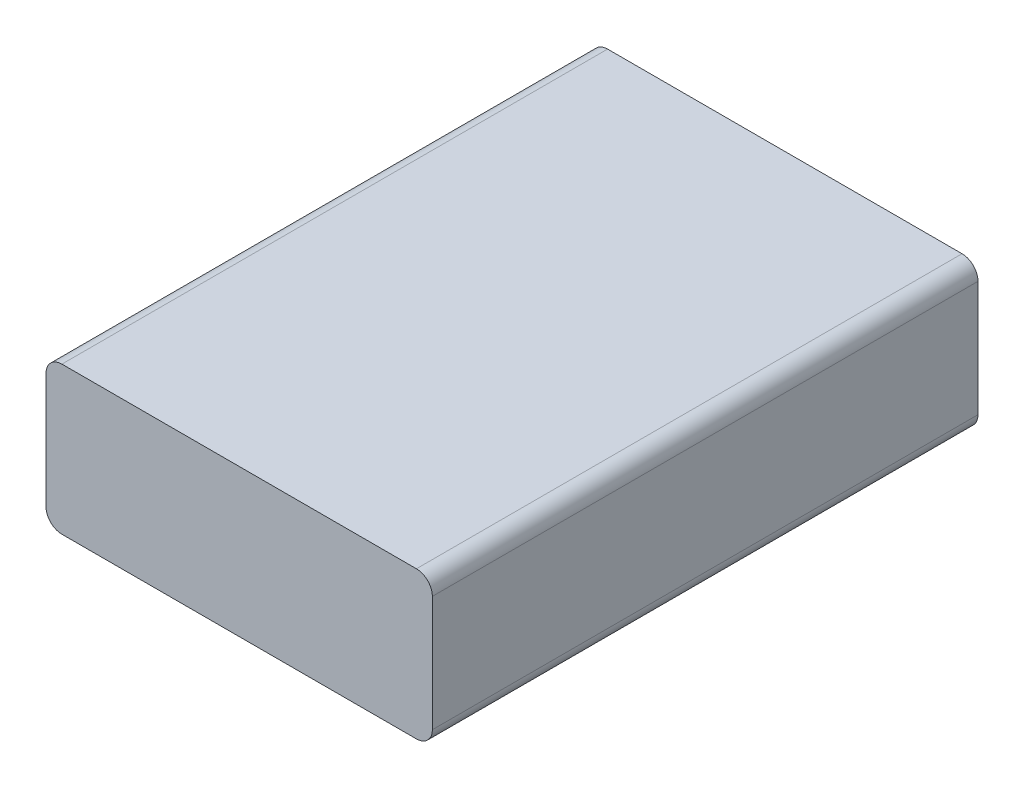
from build123d import *

# Parameters (mm, degrees)
SKETCH1_W           = 48.5
SKETCH1_H           = 68.5
BOSS_EXTRUDE1_DEPTH = 18.5
FILLET1_R           = 2


with BuildPart() as part:
    # Sketch1 → Boss-Extrude1 (new body)
    with BuildSketch(Plane(origin=(0, 0, 0), x_dir=(1, 0, 0), z_dir=(0, 1, 0))):
        Rectangle(SKETCH1_W, SKETCH1_H)
    extrude(amount=BOSS_EXTRUDE1_DEPTH)

    # Fillet1
    fillet1_edges = [part.edges().sort_by_distance(p)[0] for p in [
        (-24.25, 18.5, 0),
        (24.25, 18.5, 0),
        (-24.25, 0, 0),
        (24.25, 0, 0),
    ]]
    fillet(fillet1_edges, radius=FILLET1_R)


solid = part.part
